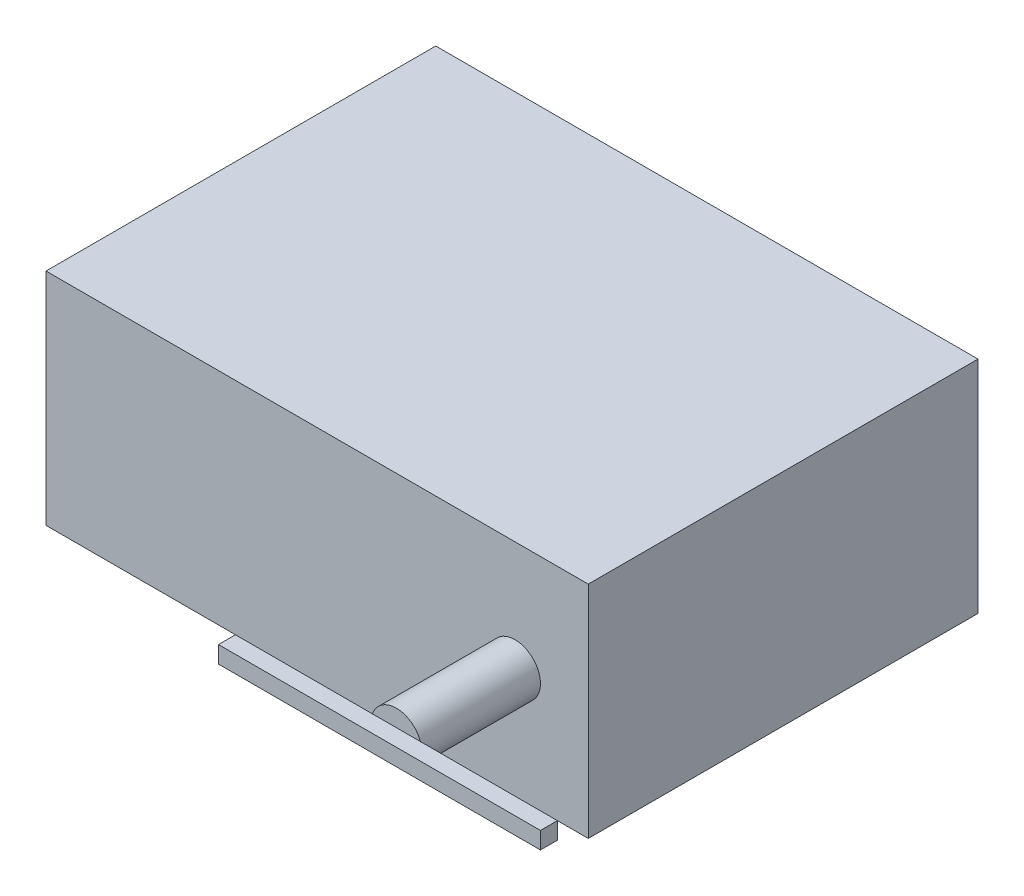
from build123d import *

# Parameters (mm, degrees)
SKETCH_1_W      = 32
SKETCH_1_H      = 13
EXTRUDE_1_DEPTH = 23
SKETCH_2_R      = 1.5
EXTRUDE_2_DEPTH = 7
SKETCH_3_W      = 9.5
SKETCH_3_H      = 1
EXTRUDE_3_DEPTH = 1


with BuildPart() as part:
    # 草图1 → 凸台-拉伸1 (new body)
    with BuildSketch(Plane.XY):
        with Locations((16, 6.5)):
            Rectangle(SKETCH_1_W, SKETCH_1_H)
    extrude(amount=EXTRUDE_1_DEPTH)

    # 草图2 → 凸台-拉伸2 (add)
    with BuildSketch(Plane.XY.offset(23)):
        with Locations((27.678688567, 6.5)):
            Circle(SKETCH_2_R)
    extrude(amount=EXTRUDE_2_DEPTH)

    # 草图3 → 凸台-拉伸3 (add)
    with BuildSketch(Plane.XY.offset(30)):
        with Locations((22.928688567, 6.5)):
            Rectangle(SKETCH_3_W, SKETCH_3_H)
    extrude_3 = extrude(amount=EXTRUDE_3_DEPTH)

    # 镜向1: 凸台-拉伸3 across plane
    add(extrude_3.mirror(Plane(origin=(27.678688567, 7, 31), x_dir=(0, 0, 1), z_dir=(-1, 0, 0))))


solid = part.part
